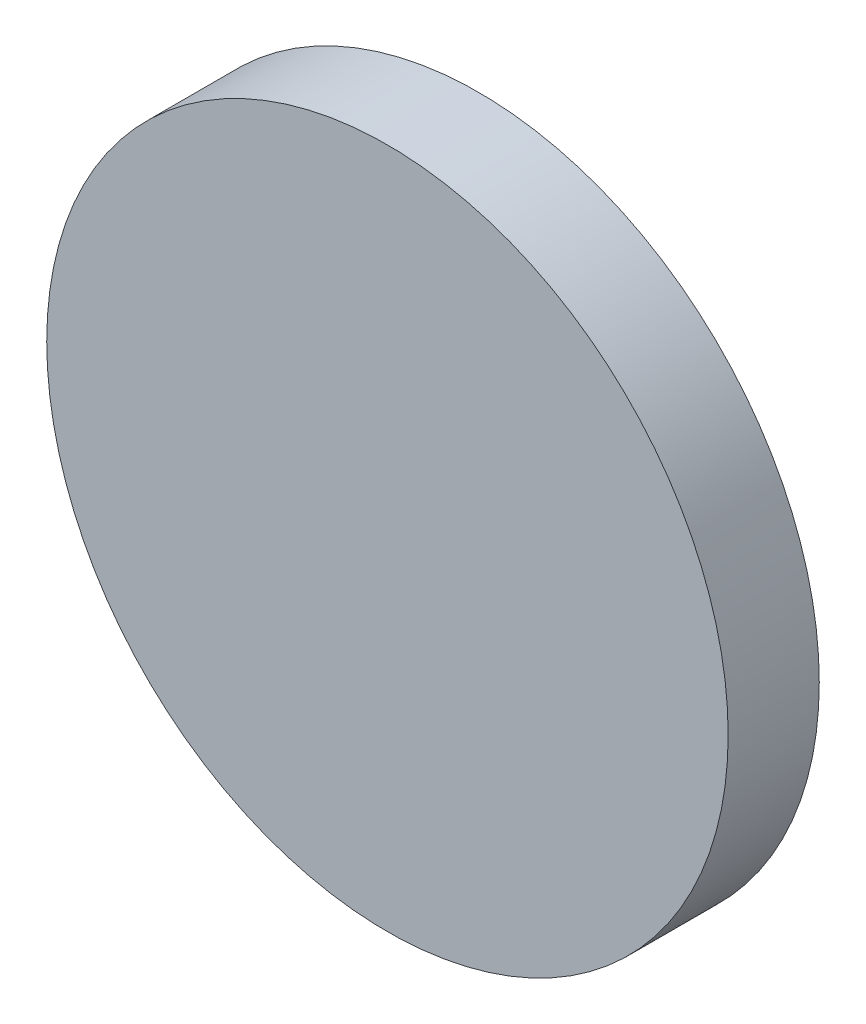
from build123d import *

# Parameters (mm, degrees)
SKETCH1_R           = 11.8745
BOSS_EXTRUDE1_DEPTH = 3.175


with BuildPart() as part:
    # Sketch1 → Boss-Extrude1 (new body)
    with BuildSketch(Plane.XY):
        Circle(SKETCH1_R)
    extrude(amount=BOSS_EXTRUDE1_DEPTH)


solid = part.part
